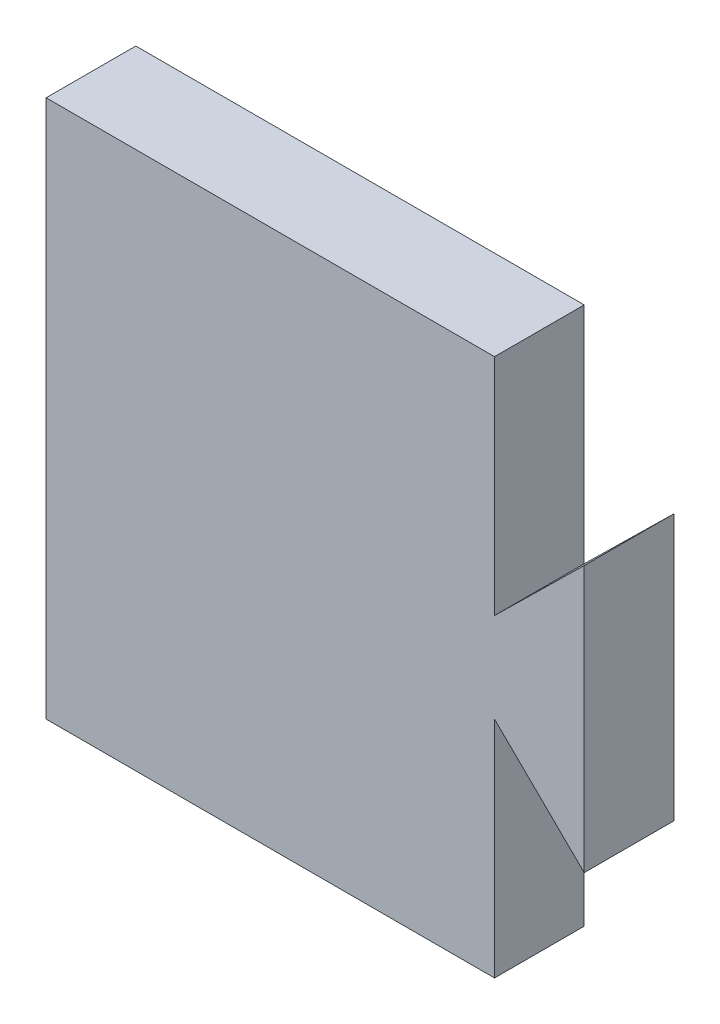
from build123d import *

# Parameters (mm, degrees)
SKETCH_2_W      = 50
SKETCH_2_H      = 60
EXTRUDE_1_DEPTH = 10
SKETCH_4_W      = 10
SKETCH_4_H      = 10
EXTRUDE_2_DEPTH = 10
EXTRUDE_3_DEPTH = 10


with BuildPart() as part:
    # 草图2 → 凸台-拉伸1 (new body)
    with BuildSketch(Plane.XY):
        with Locations((-17.786885246, -14.016393443)):
            Rectangle(SKETCH_2_W, SKETCH_2_H)
    extrude(amount=EXTRUDE_1_DEPTH)

    # 草图4 → 凸台-拉伸2 (add)
    with BuildSketch(Plane.XY.offset(10)):
        with Locations((12.213114754, -14.016393443)):
            Rectangle(SKETCH_4_W, SKETCH_4_H)
    extrude(amount=-EXTRUDE_2_DEPTH)

    # 草图5 → 凸台-拉伸3 (add)
    with BuildSketch(Plane.XY.offset(10)):
        Polygon((7.213114754, -9.016393443), (17.213114754, 0.810579189), (17.213114754, -9.016393443), align=None)
        Polygon((7.213114754, -19.016393443), (17.213114754, -19.016393443), (17.213114754, -28.843366074), align=None)
    extrude(amount=-EXTRUDE_3_DEPTH)


solid = part.part
